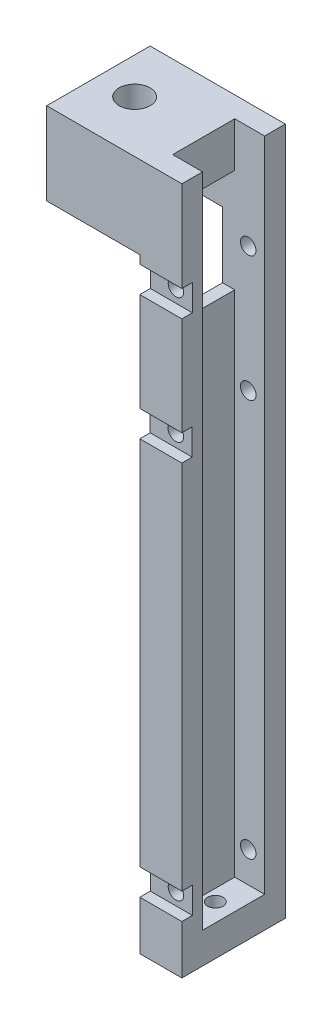
from build123d import *

# Parameters (mm, degrees)
BOSS_EXTRUDE2_DEPTH = 10
SKETCH2_W           = 6
SKETCH2_H           = 21.5
CUT_EXTRUDE1_DEPTH  = 2
SKETCH18_W          = 10
SKETCH18_H          = 4
CUT_EXTRUDE6_DEPTH  = 2.32
BOSS_EXTRUDE4_DEPTH = 35.965
SKETCH20_W          = 10
SKETCH20_H          = 4.318
BOSS_EXTRUDE5_DEPTH = 9
SKETCH21_W          = 2
SKETCH21_H          = 57.465
BOSS_EXTRUDE6_DEPTH = 0.889
BOSS_EXTRUDE7_DEPTH = 9.02
CUT_EXTRUDE7_DEPTH  = 1.016
SKETCH24_W          = 4.069
SKETCH24_H          = 2.54
CUT_EXTRUDE8_DEPTH  = 1
SKETCH30_R          = 0.75565
CUT_EXTRUDE14_DEPTH = 95.738007626
SKETCH34_R          = 1.5
CUT_EXTRUDE18_DEPTH = 10
SKETCH35_R          = 0.75
CUT_EXTRUDE19_DEPTH = 60.59814159
SKETCH36_W          = 6
SKETCH36_H          = 10
CUT_EXTRUDE20_DEPTH = 10
SKETCH37_W          = 9
SKETCH37_H          = 2
BOSS_EXTRUDE8_DEPTH = 3.65
SKETCH38_W          = 4.069
SKETCH38_H          = 10
BOSS_EXTRUDE9_DEPTH = 3
SKETCH39_R          = 0.75
CUT_EXTRUDE21_DEPTH = 3


with BuildPart() as part:
    # Sketch1 → Boss-Extrude2 (new body)
    with BuildSketch(Plane.XY):
        Polygon((-4, 0), (-0.82, 0), (-0.82, 21.5), (-6.32, 21.5), (-6.32, 17.5), (-4, 17.5), align=None)
    extrude(amount=BOSS_EXTRUDE2_DEPTH)

    # Sketch2 → Cut-Extrude1 (cut)
    with BuildSketch(Plane(origin=(-0.82, 0, 0), x_dir=(0, 0, -1), z_dir=(1, 0, 0))):
        with Locations((-5, 10.75)):
            Rectangle(SKETCH2_W, SKETCH2_H)
    extrude(amount=-CUT_EXTRUDE1_DEPTH, mode=Mode.SUBTRACT)

    # Sketch18 → Cut-Extrude6 (cut)
    with BuildSketch(Plane.ZY.offset(6.32)):
        with Locations((5, 19.5)):
            Rectangle(SKETCH18_W, SKETCH18_H)
    extrude(amount=-CUT_EXTRUDE6_DEPTH, mode=Mode.SUBTRACT)

    # Sketch19 → Boss-Extrude4 (add)
    with BuildSketch(Plane(origin=(0, 21.5, 0), x_dir=(1, 0, 0), z_dir=(0, 1, 0))):
        Polygon((-0.82, -10), (-4, -10), (-4, 0), (-0.82, 0), (-0.82, -2), (-2.82, -2), (-2.82, -8), (-0.82, -8), align=None)
    extrude(amount=BOSS_EXTRUDE4_DEPTH)

    # Sketch20 → Boss-Extrude5 (add)
    with BuildSketch(Plane.ZY.offset(4)):
        with Locations((5, 55.306)):
            Rectangle(SKETCH20_W, SKETCH20_H)
    extrude(amount=BOSS_EXTRUDE5_DEPTH)

    # Sketch21 → Boss-Extrude6 (add)
    with BuildSketch(Plane(origin=(-0.82, 0, 0), x_dir=(0, 0, -1), z_dir=(1, 0, 0))):
        with Locations((-9, 28.7325)):
            Rectangle(SKETCH21_W, SKETCH21_H)
        with Locations((-1, 28.7325)):
            Rectangle(SKETCH21_W, SKETCH21_H)
    extrude(amount=BOSS_EXTRUDE6_DEPTH)

    # Sketch22 → Boss-Extrude7 (add)
    with BuildSketch(Plane.XZ):
        Polygon((-4, 10), (0.069, 10), (0.069, 8), (-2.82, 8), (-2.82, 2), (0.069, 2), (0.069, 0), (-4, 0), align=None)
    extrude(amount=BOSS_EXTRUDE7_DEPTH)

    # Sketch23 → Cut-Extrude7 (cut)
    with BuildSketch(Plane.XY.offset(10)):
        Polygon((0.069, -3.02), (0.069, -4.29), (-4, -4.29), (-4, -1.75), (0.069, -1.75), align=None)
        Polygon((-4, 47.426731456), (-4, 48.696731456), (0.069, 48.696731456), (0.069, 46.156731456), (-4, 46.156731456), align=None)
    extrude(amount=-CUT_EXTRUDE7_DEPTH, mode=Mode.SUBTRACT)

    # Sketch24 → Cut-Extrude8 (cut)
    with BuildSketch(Plane.XY.offset(10)):
        with Locations((-1.9655, 35.355048592)):
            Rectangle(SKETCH24_W, SKETCH24_H)
    extrude(amount=-CUT_EXTRUDE8_DEPTH, mode=Mode.SUBTRACT)

    # Sketch30 → Cut-Extrude14 (cut, through all)
    with BuildSketch(Plane(origin=(35.063086629, -23.678267082, 9), x_dir=(1, 0, 0), z_dir=(0, 0, 1))):
        with Locations((-36.581586629, 59.033315674)):
            Circle(SKETCH30_R)
    extrude(amount=-CUT_EXTRUDE14_DEPTH, mode=Mode.SUBTRACT)

    # Sketch34 → Cut-Extrude18 (cut)
    with BuildSketch(Plane(origin=(0, 57.465, 0), x_dir=(1, 0, 0), z_dir=(0, 1, 0))):
        with Locations(Location((-9.5, -5, 0), (0, 0, 270))):
            Circle(SKETCH34_R)
    extrude(amount=-CUT_EXTRUDE18_DEPTH, mode=Mode.SUBTRACT)

    # Sketch35 → Cut-Extrude19 (cut, through all)
    with BuildSketch(Plane.XY.offset(8.984)):
        with Locations((-1.5185, 47.456731456)):
            Circle(SKETCH35_R)
        with Locations((-1.5185, -3.05)):
            Circle(SKETCH35_R)
    extrude(amount=-CUT_EXTRUDE19_DEPTH, mode=Mode.SUBTRACT)

    # Sketch36 → Cut-Extrude20 (cut)
    with BuildSketch(Plane(origin=(-2.82, 0, 0), x_dir=(0, 0, -1), z_dir=(1, 0, 0))):
        with Locations((-5, 48.147)):
            Rectangle(SKETCH36_W, SKETCH36_H)
    extrude(amount=-CUT_EXTRUDE20_DEPTH, mode=Mode.SUBTRACT)

    # Sketch37 → Boss-Extrude8 (add)
    with BuildSketch(Plane.XZ.offset(-53.147)):
        with Locations((-8.5, 9)):
            Rectangle(SKETCH37_W, SKETCH37_H)
        with Locations((-8.5, 1)):
            Rectangle(SKETCH37_W, SKETCH37_H)
    extrude(amount=BOSS_EXTRUDE8_DEPTH)

    # Sketch38 → Boss-Extrude9 (add)
    with BuildSketch(Plane.XZ.offset(9.02)):
        with Locations((-1.9655, 5)):
            Rectangle(SKETCH38_W, SKETCH38_H)
    extrude(amount=-BOSS_EXTRUDE9_DEPTH)

    # Sketch39 → Cut-Extrude21 (cut)
    with BuildSketch(Plane.XZ.offset(9.02)):
        with Locations(Location((-1.7, 5, 0), (0, 0, 270))):
            Circle(SKETCH39_R)
    extrude(amount=-CUT_EXTRUDE21_DEPTH, mode=Mode.SUBTRACT)


solid = part.part
